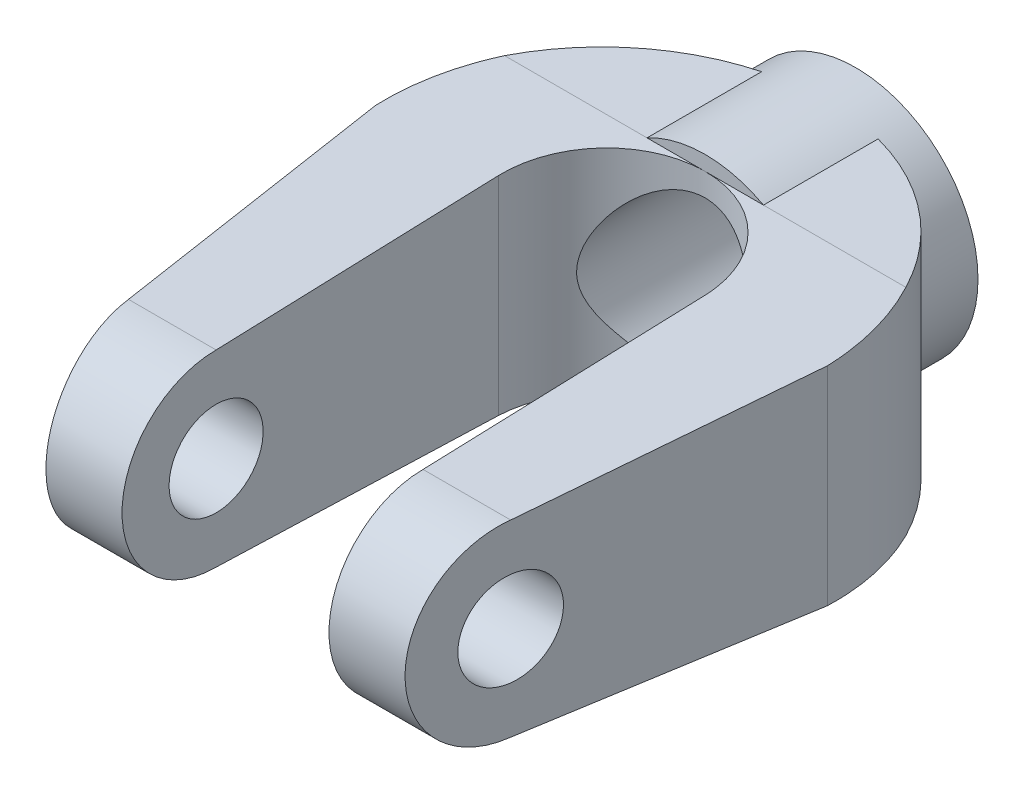
from build123d import *
from build123d.topology import SkipClean

# Parameters (mm, degrees)
SKETCH1_R                = 13
BOSS_EXTRUDE1_DEPTH      = 16
BOSS_EXTRUDE2_DEPTH      = 11.431752
BOSS_EXTRUDE2_DEPTH_BACK = 11.431752
CUT_EXTRUDE1_DEPTH       = 73.346389042
CUT_EXTRUDE1_DEPTH_BACK  = 73.346389042
CUT_EXTRUDE2_DEPTH       = 73.346389042
CUT_EXTRUDE2_DEPTH_BACK  = 73.346389042
SKETCH4_R                = 5
CUT_EXTRUDE3_DEPTH       = 73.346389042
CUT_EXTRUDE3_DEPTH_BACK  = 73.346389042
SKETCH5_R                = 9


with BuildPart() as part:
    # Sketch1 → Boss-Extrude1 (new body)
    with BuildSketch(Plane.XY):
        Circle(SKETCH1_R)
    extrude(amount=BOSS_EXTRUDE1_DEPTH)

    # Sketch2 → Boss-Extrude2 (add, two sides: drawn at the far end of the back side and taken through both)
    with BuildSketch(Plane(origin=(0, 0, 0), x_dir=(1, 0, 0), z_dir=(0, 1, 0)).offset(-BOSS_EXTRUDE2_DEPTH_BACK)):
        with BuildLine():
            Line((-11, -27), (-11, -67))
            Line((-11, -67), (-19.088617564, -67))
            Line((-19.088617564, -67), (-24, -27))
            ThreePointArc((-24, -27), (-16.970562748, -10.029437252), (0, -3))
            ThreePointArc((0, -3), (16.970562748, -10.029437252), (24, -27))
            Line((24, -27), (19.088617564, -67))
            Line((19.088617564, -67), (11, -67))
            Line((11, -67), (11, -27))
            ThreePointArc((11, -27), (7.778174593, -19.221825407), (0, -16))
            ThreePointArc((0, -16), (-7.778174593, -19.221825407), (-11, -27))
        make_face()
    extrude(amount=BOSS_EXTRUDE2_DEPTH + BOSS_EXTRUDE2_DEPTH_BACK)

    # Sketch3 → Cut-Extrude1 (cut, two sides: drawn at the far end of the back side and taken through both)
    with BuildSketch(Plane(origin=(0, 0, 0), x_dir=(0, 0, -1), z_dir=(1, 0, 0)).offset(-CUT_EXTRUDE1_DEPTH_BACK)):
        with BuildLine():
            ThreePointArc((-67, 0), (-64.071067812, 7.071067812), (-57, 10))
            Line((-57, 10), (-16, 11.431751549))
            Line((-16, 11.431751549), (-16, 13))
            Line((-16, 13), (-67, 13))
            Line((-67, 13), (-67, 0))
        make_face()
        with BuildLine():
            ThreePointArc((-57, -10), (-64.071067812, -7.071067812), (-67, 0))
            Line((-67, 0), (-67, -13))
            Line((-67, -13), (-16, -13))
            Line((-16, -13), (-16, -11.431751549))
            Line((-16, -11.431751549), (-57, -10))
        make_face()
    extrude(amount=CUT_EXTRUDE1_DEPTH + CUT_EXTRUDE1_DEPTH_BACK, mode=Mode.SUBTRACT)

    # Sketch4 → Cut-Extrude2 (cut, two sides: drawn at the far end of the back side and taken through both)
    with BuildSketch(Plane(origin=(0, 0, 0), x_dir=(0, 0, -1), z_dir=(1, 0, 0)).offset(-CUT_EXTRUDE2_DEPTH_BACK)):
        with Locations(Location((-57, 0, 0), (0, 0, 180))):
            Circle(SKETCH4_R)
    extrude(amount=CUT_EXTRUDE2_DEPTH + CUT_EXTRUDE2_DEPTH_BACK, mode=Mode.SUBTRACT)

    # Sketch5 → Cut-Extrude3 (cut, two sides: drawn at the far end of the back side and taken through both)
    with SkipClean():  # the faces are left unmerged after this step: merging them gives an invalid solid
        with BuildSketch(Plane(origin=(0, 0, 0), x_dir=(-1, 0, 0), z_dir=(0, 0, -1)).offset(-CUT_EXTRUDE3_DEPTH_BACK)):
            Circle(SKETCH5_R)
        extrude(amount=CUT_EXTRUDE3_DEPTH + CUT_EXTRUDE3_DEPTH_BACK, mode=Mode.SUBTRACT)


solid = part.part
